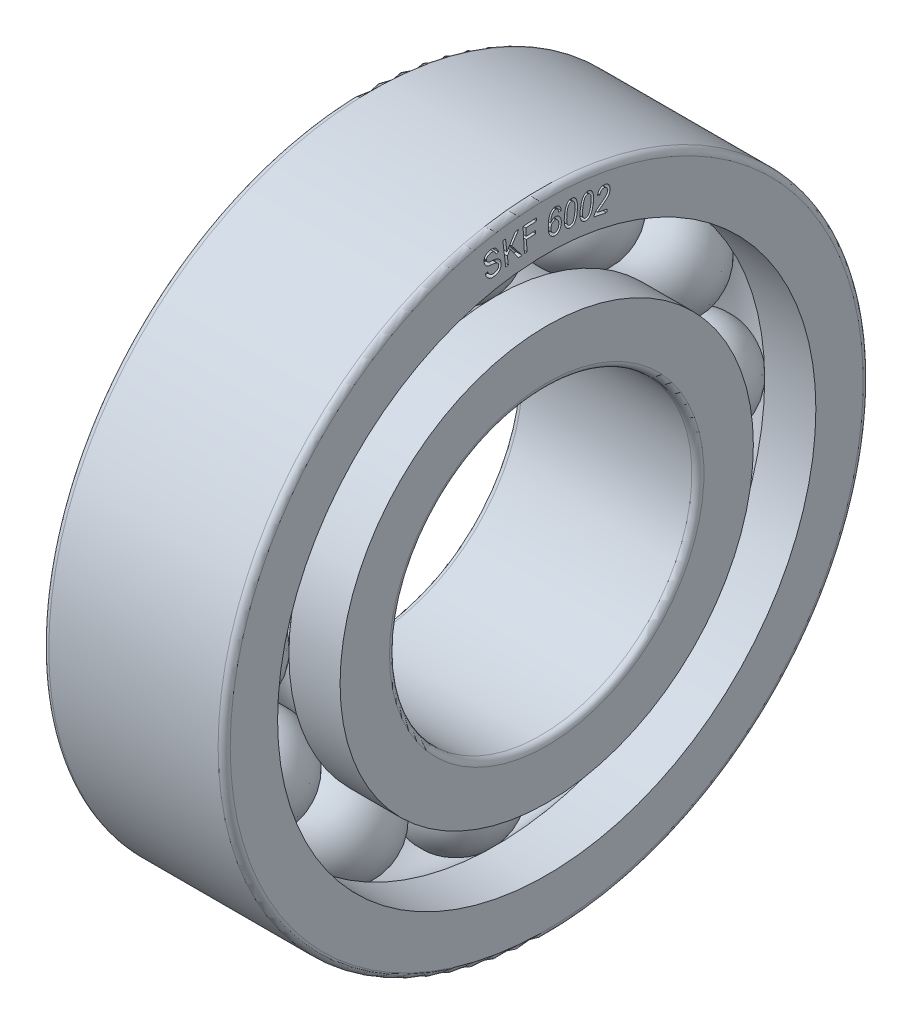
from build123d import *

# Parameters (mm, degrees)
FILLET1_R          = 0.3
FILLET2_R          = 0.3
CIRPATTERN2_COUNT  = 12
CUT_EXTRUDE1_DEPTH = 0.3


with BuildPart() as part:
    # Sketch1 → Revolve1 (revolve)
    with BuildSketch(Plane.XY, mode=Mode.PRIVATE) as revolve1_sk:
        with BuildLine():
            Line((0, 13.35), (2.538495475, 13.35))
            ThreePointArc((2.538495475, 13.35), (4.5, 14.3), (6.461504525, 13.35))
            Line((6.461504525, 13.35), (9, 13.35))
            Line((9, 13.35), (9, 16))
            Line((9, 16), (0, 16))
            Line((0, 16), (0, 13.35))
        make_face()
        with BuildLine():
            Line((0, 7.5), (9, 7.5))
            Line((9, 7.5), (9, 10.25))
            Line((9, 10.25), (6.461504525, 10.25))
            ThreePointArc((6.461504525, 10.25), (4.5, 9.3), (2.538495475, 10.25))
            Line((2.538495475, 10.25), (0, 10.25))
            Line((0, 10.25), (0, 7.5))
        make_face()
    revolve(revolve1_sk.sketch.rotate(Axis((0, 0, 0), (1, 0, 0)), 90), axis=Axis((0, 0, 0), (1, 0, 0)))

    # Fillet1
    fillet1_edges = [part.edges().sort_by_distance(p)[0] for p in [
        (0, 0, -16),
        (9, 0, -16),
    ]]
    fillet(fillet1_edges, radius=FILLET1_R)

    # Fillet2
    fillet2_edges = [part.edges().sort_by_distance(p)[0] for p in [
        (9, 0, -7.5),
        (0, 0, -7.5),
    ]]
    fillet(fillet2_edges, radius=FILLET2_R)

    # Sketch4 → Cut-Extrude1 (cut)
    # profile 1 of 7: a face of its own
    with BuildSketch(Plane(origin=(9, 0, 0), x_dir=(0, 0, -1), z_dir=(1, 0, 0))):
        with BuildLine():
            Line((-3.046650732, 14.00714184), (-2.92806307, 14.042937295))
            add(Edge.make_bspline(
                [(-2.92806307, 14.042937295), (-2.923301458, 14.027825448), (-2.914277799, 13.999187217), (-2.897284214, 13.959900181), (-2.878064176, 13.926640691), (-2.856519588, 13.898826321), (-2.832107487, 13.875936734), (-2.804652981, 13.857083888), (-2.774240384, 13.84139606), (-2.740861304, 13.829319608), (-2.705316332, 13.820993642), (-2.668089749, 13.817493292), (-2.629716039, 13.817994887), (-2.604084929, 13.822153551), (-2.591050083, 13.824268464)],
                knots=[0, 0, 0, 0, 1.26954719, 2.40589959, 3.423657765, 4.341315027, 5.215932511, 6.094943994, 7.002907502, 7.951842905, 8.933583934, 9.920936739, 10.942680602, 12, 12, 12, 12], degree=3))
            add(Edge.make_bspline(
                [(-2.591050083, 13.824268464), (-2.581765006, 13.82616495), (-2.563693597, 13.829856053), (-2.537889809, 13.837431966), (-2.513955786, 13.846404018), (-2.49221225, 13.857238024), (-2.471907098, 13.868789897), (-2.453865498, 13.882307036), (-2.437643865, 13.897189766), (-2.423595439, 13.913566909), (-2.411294627, 13.930851366), (-2.401368313, 13.949017107), (-2.393688814, 13.96791058), (-2.388085389, 13.987328093), (-2.384625857, 14.007581973), (-2.383480417, 14.028399642), (-2.384409269, 14.049952146), (-2.38675906, 14.06430231), (-2.387965667, 14.071671061)],
                knots=[0, 0, 0, 0, 1.2593084, 2.450973213, 3.571176115, 4.6521319, 5.677366795, 6.672228266, 7.641962316, 8.59815497, 9.535160328, 10.457450196, 11.343097648, 12.241276623, 13.138872091, 14.068392264, 15.008127251, 16, 16, 16, 16], degree=3))
            add(Edge.make_bspline(
                [(-2.387965667, 14.071671061), (-2.389877515, 14.080086013), (-2.39360091, 14.096474453), (-2.402366844, 14.119577918), (-2.414035562, 14.14028436), (-2.427960588, 14.158936579), (-2.444401987, 14.175505406), (-2.463733209, 14.189434381), (-2.485558199, 14.201222332), (-2.506194323, 14.208879848), (-2.525328466, 14.2143538), (-2.543456321, 14.218011158), (-2.564855352, 14.222229644), (-2.589772757, 14.226374905), (-2.618294187, 14.230178987), (-2.650300676, 14.233946574), (-2.685733189, 14.238281961), (-2.710524028, 14.240644058), (-2.723517615, 14.2418821)],
                knots=[0, 0, 0, 0, 1.00779301, 1.962715563, 2.875867978, 3.77711567, 4.676013559, 5.592510866, 6.551805949, 7.566673775, 8.158289259, 8.876535978, 9.726811044, 10.707814062, 11.828102411, 13.089528156, 14.474538576, 16, 16, 16, 16], degree=3))
            add(Edge.make_bspline(
                [(-2.723517615, 14.2418821), (-2.735213144, 14.243119933), (-2.757742602, 14.24550441), (-2.790294473, 14.249944509), (-2.820354395, 14.25471972), (-2.847969421, 14.260074926), (-2.873081499, 14.265875277), (-2.895766399, 14.272166467), (-2.916034317, 14.278929023), (-2.939562264, 14.288532414), (-2.96606402, 14.302888458), (-2.995168114, 14.323039529), (-3.021467618, 14.346787134), (-3.045172423, 14.373478746), (-3.065482159, 14.403612702), (-3.081989514, 14.436829636), (-3.09543671, 14.472685151), (-3.100866271, 14.498043265), (-3.103631252, 14.510956776)],
                knots=[0, 0, 0, 0, 1.10964656, 2.137546373, 3.099504595, 3.981192456, 4.791175181, 5.530750114, 6.201623188, 6.806082298, 7.926512849, 9.037691305, 10.138661259, 11.261889133, 12.398329616, 13.556017161, 14.755412262, 16, 16, 16, 16], degree=3))
            add(Edge.make_bspline(
                [(-3.103631252, 14.510956776), (-3.105552518, 14.522699831), (-3.109325733, 14.545762265), (-3.111189847, 14.580182892), (-3.110032929, 14.61344205), (-3.105742961, 14.645642129), (-3.097734588, 14.676643254), (-3.087177552, 14.706814965), (-3.07278872, 14.735676537), (-3.055582645, 14.763374603), (-3.035526337, 14.789343553), (-3.012576466, 14.812928176), (-2.987272727, 14.83416991), (-2.95922176, 14.85278916), (-2.928666165, 14.868833952), (-2.89557194, 14.882495266), (-2.859965469, 14.893755532), (-2.835095278, 14.899068583), (-2.822381252, 14.901784698)],
                knots=[0, 0, 0, 0, 1.053189865, 2.068381731, 3.046662068, 3.997187907, 4.938646346, 5.877686698, 6.822842677, 7.788255941, 8.761691245, 9.722490415, 10.69717237, 11.682059317, 12.698166961, 13.748777853, 14.84914037, 16, 16, 16, 16], degree=3))
            add(Edge.make_bspline(
                [(-2.822381252, 14.901784698), (-2.804813759, 14.904639967), (-2.770561209, 14.910207082), (-2.71965911, 14.911341032), (-2.671153774, 14.906516175), (-2.62527839, 14.895861737), (-2.582289492, 14.879496496), (-2.542720256, 14.857495806), (-2.506991257, 14.829569151), (-2.475343637, 14.796169373), (-2.447451315, 14.758108624), (-2.424302477, 14.715197061), (-2.405292375, 14.668007504), (-2.396898017, 14.634376164), (-2.392592291, 14.617125607)],
                knots=[0, 0, 0, 0, 1.104477071, 2.153475001, 3.151815611, 4.125288377, 5.070058186, 6.000007743, 6.926849633, 7.875405572, 8.849557026, 9.849068203, 10.896720369, 12, 12, 12, 12], degree=3))
            Line((-2.392592291, 14.617125607), (-2.513858524, 14.582547685))
            add(Edge.make_bspline(
                [(-2.513858524, 14.582547685), (-2.516600426, 14.591669176), (-2.521915868, 14.609352073), (-2.531294177, 14.634633406), (-2.542459157, 14.657501678), (-2.55409858, 14.678663799), (-2.567778774, 14.697150095), (-2.582044103, 14.714006336), (-2.597966163, 14.72832123), (-2.614941481, 14.740648493), (-2.633020441, 14.750984534), (-2.652449773, 14.759006134), (-2.672943158, 14.765053831), (-2.694617529, 14.769311345), (-2.717476202, 14.771101001), (-2.741407724, 14.771063598), (-2.766509431, 14.769177592), (-2.78344034, 14.766218921), (-2.792186447, 14.764690542)],
                knots=[0, 0, 0, 0, 1.219554854, 2.364225483, 3.44736661, 4.476085449, 5.451111343, 6.386789839, 7.299146488, 8.184768409, 9.069108721, 9.958928646, 10.869804148, 11.801317367, 12.781811824, 13.800347428, 14.863711533, 16, 16, 16, 16], degree=3))
            add(Edge.make_bspline(
                [(-2.792186447, 14.764690542), (-2.80097383, 14.762834579), (-2.818009407, 14.759236533), (-2.842561316, 14.752459709), (-2.865126736, 14.744253812), (-2.885798988, 14.734678195), (-2.904514059, 14.723977115), (-2.921581902, 14.712316287), (-2.936488071, 14.699089162), (-2.94934706, 14.684698462), (-2.960442261, 14.669560716), (-2.969376537, 14.653618028), (-2.976872692, 14.637340412), (-2.981977273, 14.620283364), (-2.985147274, 14.602718261), (-2.986328611, 14.584592699), (-2.985657219, 14.565969344), (-2.983636557, 14.553555109), (-2.982608524, 14.547239243)],
                knots=[0, 0, 0, 0, 1.322262895, 2.563392233, 3.746844923, 4.853710312, 5.913638557, 6.918215452, 7.891888192, 8.839766151, 9.755373262, 10.649272019, 11.526638814, 12.388648758, 13.263080117, 14.149517218, 15.058548406, 16, 16, 16, 16], degree=3))
            add(Edge.make_bspline(
                [(-2.982608524, 14.547239243), (-2.98005392, 14.535965724), (-2.975180508, 14.51445926), (-2.961055659, 14.4857926), (-2.943358495, 14.461265098), (-2.927600237, 14.449719379), (-2.919783849, 14.44399249)],
                knots=[0, 0, 0, 0, 1.112967713, 2.123205869, 3.069075453, 4, 4, 4, 4], degree=3))
            add(Edge.make_bspline(
                [(-2.919783849, 14.44399249), (-2.915210885, 14.441367193), (-2.905232627, 14.435638768), (-2.887719484, 14.428840922), (-2.867078877, 14.422285434), (-2.843139315, 14.416534826), (-2.815973315, 14.411502528), (-2.78558991, 14.406956549), (-2.751908173, 14.402732653), (-2.728315348, 14.40072496), (-2.715968914, 14.399674308)],
                knots=[0, 0, 0, 0, 0.60165213, 1.312811475, 2.13979566, 3.075369995, 4.122893511, 5.295289476, 6.584589636, 8, 8, 8, 8], degree=3))
            add(Edge.make_bspline(
                [(-2.715968914, 14.399674308), (-2.703789017, 14.398666953), (-2.680388162, 14.396731552), (-2.646724266, 14.393177536), (-2.615749859, 14.389990084), (-2.587534221, 14.385962237), (-2.562042696, 14.382095642), (-2.539244476, 14.378363706), (-2.519302409, 14.373931297), (-2.506951196, 14.370728384), (-2.501196187, 14.369235996)],
                knots=[0, 0, 0, 0, 1.350462932, 2.594602265, 3.7406246, 4.790933121, 5.743598289, 6.590013479, 7.343021209, 8, 8, 8, 8], degree=3))
            add(Edge.make_bspline(
                [(-2.501196187, 14.369235996), (-2.485625294, 14.364099715), (-2.455285497, 14.354091699), (-2.413200751, 14.332975565), (-2.376017761, 14.306978443), (-2.343822483, 14.276215491), (-2.316356685, 14.240923039), (-2.294244548, 14.200872403), (-2.276872924, 14.156226541), (-2.269842219, 14.124390023), (-2.266212421, 14.107953529)],
                knots=[0, 0, 0, 0, 1.056785043, 2.059139661, 3.025273026, 3.973485492, 4.92146656, 5.899070255, 6.915336187, 8, 8, 8, 8], degree=3))
            add(Edge.make_bspline(
                [(-2.266212421, 14.107953529), (-2.263690315, 14.091193147), (-2.258738272, 14.058284868), (-2.258455057, 14.008607444), (-2.265216865, 13.960261763), (-2.27777995, 13.913486524), (-2.296230216, 13.869512338), (-2.319976555, 13.829056728), (-2.34931363, 13.792910079), (-2.383876511, 13.761018087), (-2.423863427, 13.733885162), (-2.468796679, 13.711074282), (-2.519127837, 13.693312611), (-2.554829209, 13.685411971), (-2.573274109, 13.681330152)],
                knots=[0, 0, 0, 0, 1.03110276, 2.02452526, 3.012164937, 3.995280586, 4.965503464, 5.907210424, 6.841953011, 7.789813294, 8.760388578, 9.774929382, 10.850430571, 12, 12, 12, 12], degree=3))
            add(Edge.make_bspline(
                [(-2.573274109, 13.681330152), (-2.587932195, 13.678866845), (-2.61663503, 13.674043303), (-2.659363686, 13.671549638), (-2.700442698, 13.672327177), (-2.739877954, 13.677161744), (-2.777619236, 13.686055768), (-2.813864576, 13.698398365), (-2.848333921, 13.714887358), (-2.880994668, 13.734853577), (-2.911479011, 13.758242088), (-2.939308499, 13.784866836), (-2.964359823, 13.814593385), (-2.98640933, 13.847355982), (-3.00614745, 13.882856093), (-3.022499182, 13.921554578), (-3.036654289, 13.963086368), (-3.043263767, 13.992215096), (-3.046650732, 14.00714184)],
                knots=[0, 0, 0, 0, 1.101815366, 2.15752762, 3.169301812, 4.146094599, 5.098288644, 6.040782667, 6.980676967, 7.926530366, 8.875463887, 9.825084765, 10.77790675, 11.753139638, 12.750207159, 13.785847731, 14.865378402, 16, 16, 16, 16], degree=3))
        make_face()
    # profile 2 of 7: a face of its own
    with BuildSketch(Plane(origin=(9, 0, 0), x_dir=(0, 0, -1), z_dir=(1, 0, 0))):
        Polygon((-2.032785019, 13.798009574), (-2.17718437, 14.991678405), (-2.047882422, 15.00726282), (-1.976291513, 14.415298535), (-1.561599954, 15.066191392), (-1.385788266, 15.087376457), (-1.738629175, 14.554097236), (-1.223612941, 13.895899184), (-1.3945545, 13.875201132), (-1.81606424, 14.437214119), (-1.953645409, 14.227311522), (-1.903483071, 13.813593989), align=None)
    # profile 3 of 7: a face of its own
    with BuildSketch(Plane(origin=(9, 0, 0), x_dir=(0, 0, -1), z_dir=(1, 0, 0))):
        Polygon((-1.10624178, 13.902935611), (-1.17564113, 15.107805741), (-0.509163858, 15.146279767), (-0.501128143, 15.004071974), (-1.036842429, 14.97314665), (-1.015170351, 14.600094702), (-0.551777494, 14.626880416), (-0.54374178, 14.484672624), (-1.007134637, 14.45788691), (-0.975478793, 13.910484312), align=None)
    # profile 4 of 7: a face of its own
    with BuildSketch(Plane(origin=(9, 0, 0), x_dir=(0, 0, -1), z_dir=(1, 0, 0))):
        with BuildLine():
            Line((0.720598831, 14.84074259), (0.599576104, 14.832706876))
            add(Edge.make_bspline(
                [(0.599576104, 14.832706876), (0.597009192, 14.847219242), (0.592216782, 14.874313746), (0.581531024, 14.911184161), (0.569193021, 14.941934512), (0.557650268, 14.95851471), (0.552335844, 14.966148434)],
                knots=[0, 0, 0, 0, 1.236380282, 2.308314765, 3.221127598, 4, 4, 4, 4], degree=3))
            add(Edge.make_bspline(
                [(0.552335844, 14.966148434), (0.548353343, 14.970843347), (0.540581809, 14.980005095), (0.527902145, 14.992306851), (0.514373789, 15.002620207), (0.500218273, 15.011122955), (0.485521708, 15.01813296), (0.470005736, 15.022927109), (0.453844376, 15.026204429), (0.44277349, 15.026910418), (0.437157273, 15.027268564)],
                knots=[0, 0, 0, 0, 1.095410301, 2.13760608, 3.137382949, 4.116060655, 5.072628854, 6.027559187, 6.999388418, 8, 8, 8, 8], degree=3))
            add(Edge.make_bspline(
                [(0.437157273, 15.027268564), (0.428445676, 15.027066389), (0.411331365, 15.026669206), (0.386148191, 15.02113258), (0.362437479, 15.011242836), (0.339825584, 14.997293001), (0.318604554, 14.979036408), (0.29870055, 14.956629701), (0.279684643, 14.930357764), (0.268918845, 14.910682271), (0.263293637, 14.900401681)],
                knots=[0, 0, 0, 0, 0.916849156, 1.801189937, 2.69883847, 3.612969371, 4.59010406, 5.638077774, 6.765878283, 8, 8, 8, 8], degree=3))
            add(Edge.make_bspline(
                [(0.263293637, 14.900401681), (0.258581182, 14.890570237), (0.248782003, 14.870126524), (0.236874683, 14.836794262), (0.226032143, 14.800269739), (0.217482575, 14.760086404), (0.21024958, 14.716610147), (0.204388886, 14.669664414), (0.20027174, 14.619374282), (0.198955034, 14.584662092), (0.198277403, 14.566797785)],
                knots=[0, 0, 0, 0, 0.763653091, 1.587956324, 2.477226605, 3.432398784, 4.46489177, 5.565636566, 6.747177368, 8, 8, 8, 8], degree=3))
            add(Edge.make_bspline(
                [(0.198277403, 14.566797785), (0.205762689, 14.579186291), (0.220265634, 14.603189356), (0.246545721, 14.634799808), (0.274737678, 14.662097894), (0.305998989, 14.683636783), (0.338443815, 14.700914876), (0.372308114, 14.712590597), (0.406804015, 14.719903739), (0.430140949, 14.720105978), (0.441783896, 14.720206876)],
                knots=[0, 0, 0, 0, 1.145987755, 2.22038229, 3.249078672, 4.247004615, 5.219843421, 6.153966187, 7.079001852, 8, 8, 8, 8], degree=3))
            add(Edge.make_bspline(
                [(0.441783896, 14.720206876), (0.451391577, 14.719641742), (0.470530245, 14.718515987), (0.49855602, 14.71245733), (0.525534544, 14.703444642), (0.551505031, 14.691094335), (0.576265638, 14.675185912), (0.600005344, 14.655985429), (0.622764119, 14.633657147), (0.644253965, 14.608265498), (0.663934578, 14.580130828), (0.681084395, 14.549584929), (0.695155795, 14.516717957), (0.706689575, 14.481792041), (0.715081883, 14.444586319), (0.720951769, 14.405283871), (0.723847034, 14.363757747), (0.723631383, 14.335388922), (0.723520909, 14.320856226)],
                knots=[0, 0, 0, 0, 0.849327429, 1.691875088, 2.524226795, 3.35830704, 4.225761169, 5.118464095, 6.051648941, 7.038832616, 8.053535028, 9.081032545, 10.128240177, 11.207808131, 12.32647642, 13.493924435, 14.716195167, 16, 16, 16, 16], degree=3))
            add(Edge.make_bspline(
                [(0.723520909, 14.320856226), (0.7224559, 14.301175445), (0.720366329, 14.262561325), (0.710540937, 14.206267325), (0.695020034, 14.15302669), (0.677976961, 14.111008696), (0.661442044, 14.079801248), (0.649064773, 14.057729722), (0.635169815, 14.037819184), (0.621112859, 14.019088994), (0.606039371, 14.002078299), (0.590187302, 13.986769203), (0.573815102, 13.97288114), (0.550903439, 13.957306365), (0.521128247, 13.940887411), (0.483220279, 13.927073233), (0.443567761, 13.919334113), (0.416654447, 13.918835328), (0.403066364, 13.918583499)],
                knots=[0, 0, 0, 0, 1.650803297, 3.238911819, 4.776053236, 6.292019915, 7.028348408, 7.735437623, 8.410929891, 9.061291689, 9.697408685, 10.313194819, 10.907215888, 11.494065414, 12.632559363, 13.747290788, 14.862644748, 16, 16, 16, 16], degree=3))
            add(Edge.make_bspline(
                [(0.403066364, 13.918583499), (0.390854586, 13.919331586), (0.366791903, 13.920805654), (0.331764261, 13.928290767), (0.298541254, 13.939801263), (0.267121315, 13.955541071), (0.237475079, 13.975471932), (0.209485994, 13.999554041), (0.183560818, 14.02798198), (0.159043817, 14.060394718), (0.13731193, 14.097920573), (0.118862191, 14.140944687), (0.10364893, 14.189429272), (0.091643432, 14.243373037), (0.082761906, 14.302775269), (0.076998318, 14.367657046), (0.07471726, 14.438131742), (0.075425873, 14.486927693), (0.075793637, 14.51225233)],
                knots=[0, 0, 0, 0, 0.772682147, 1.522530541, 2.256134036, 2.990562792, 3.73782516, 4.509330465, 5.31922407, 6.166000266, 7.074374683, 8.053506931, 9.119834925, 10.282666614, 11.544110306, 12.914761338, 14.398790295, 16, 16, 16, 16], degree=3))
            add(Edge.make_bspline(
                [(0.075793637, 14.51225233), (0.076846554, 14.540350795), (0.078872917, 14.594426913), (0.085747819, 14.672347252), (0.095259579, 14.74390334), (0.107841374, 14.809142134), (0.12317894, 14.868095809), (0.141867556, 14.92056498), (0.163218921, 14.966870041), (0.18765204, 15.00696375), (0.214804064, 15.041140479), (0.242968901, 15.07100716), (0.273160712, 15.095747134), (0.304800613, 15.116035524), (0.33822544, 15.131519713), (0.373337274, 15.142337321), (0.410161132, 15.148315038), (0.435188404, 15.148460886), (0.447871559, 15.148534798)],
                knots=[0, 0, 0, 0, 1.641067973, 3.158271576, 4.564049669, 5.852839019, 7.034251358, 8.116259258, 9.099737573, 10.005768793, 10.849329324, 11.643505027, 12.397562096, 13.121780427, 13.831913651, 14.540781322, 15.260506814, 16, 16, 16, 16], degree=3))
            add(Edge.make_bspline(
                [(0.447871559, 15.148534798), (0.457062466, 15.148070325), (0.475216575, 15.147152886), (0.501684399, 15.142605224), (0.527069579, 15.13618602), (0.550979332, 15.126769911), (0.573756353, 15.115206097), (0.595631138, 15.101695164), (0.615783833, 15.085123633), (0.634846332, 15.066621592), (0.652436834, 15.045924372), (0.668078391, 15.022889211), (0.681672767, 14.997605924), (0.693659916, 14.97038607), (0.703375584, 14.940921032), (0.711026818, 14.909381042), (0.71730622, 14.875832352), (0.719484533, 14.852617805), (0.720598831, 14.84074259)],
                knots=[0, 0, 0, 0, 0.968540519, 1.913085379, 2.823463735, 3.72212398, 4.613023276, 5.512049484, 6.424032314, 7.355131703, 8.30753763, 9.279806868, 10.282172273, 11.327377702, 12.40884574, 13.545191558, 14.744262386, 16, 16, 16, 16], degree=3))
        make_face()
        with BuildLine():
            add(Edge.make_bspline(
                [(0.210696234, 14.334979603), (0.21051902, 14.324341404), (0.21017362, 14.30360697), (0.212628654, 14.273287281), (0.216244712, 14.244412869), (0.222539071, 14.217131397), (0.230089795, 14.191174351), (0.240251173, 14.166954128), (0.252113148, 14.14422499), (0.266002389, 14.12332495), (0.281246912, 14.10456419), (0.297077332, 14.08780036), (0.313706799, 14.073556779), (0.33109475, 14.061783802), (0.349175881, 14.052322168), (0.368115051, 14.045925669), (0.387499174, 14.041168148), (0.400764898, 14.0404534), (0.407449481, 14.040093239)],
                knots=[0, 0, 0, 0, 1.299560296, 2.532914284, 3.714222581, 4.852640015, 5.951064926, 7.014066507, 8.056879126, 9.080402987, 10.075059155, 11.008253797, 11.894887359, 12.745087238, 13.570323278, 14.379786338, 15.183576162, 16, 16, 16, 16], degree=3))
            add(Edge.make_bspline(
                [(0.407449481, 14.040093239), (0.41330434, 14.040187087), (0.425009548, 14.040374708), (0.442405993, 14.043353268), (0.459428737, 14.048810463), (0.475978817, 14.056693357), (0.492200733, 14.066753127), (0.507858618, 14.079294594), (0.522863736, 14.094353352), (0.53779228, 14.111171624), (0.551239991, 14.130453672), (0.563640018, 14.151391883), (0.57364665, 14.174495747), (0.582568169, 14.199063163), (0.589315055, 14.225591862), (0.594268394, 14.253851635), (0.59814379, 14.283908522), (0.598928865, 14.304609753), (0.599332598, 14.315255577)],
                knots=[0, 0, 0, 0, 0.757529254, 1.514474783, 2.275787342, 3.065806442, 3.882578432, 4.742839754, 5.657152373, 6.633195641, 7.6511357, 8.696866962, 9.779155802, 10.906307873, 12.079151298, 13.318378039, 14.620947872, 16, 16, 16, 16], degree=3))
            add(Edge.make_bspline(
                [(0.599332598, 14.315255577), (0.599482369, 14.32564817), (0.599774029, 14.345886461), (0.597710314, 14.375410843), (0.594152382, 14.403161813), (0.588826743, 14.429250343), (0.581555774, 14.453528911), (0.572569905, 14.476058066), (0.56175093, 14.496805982), (0.549133791, 14.515649357), (0.535279501, 14.532610207), (0.520735579, 14.547712027), (0.504917166, 14.56010083), (0.488574674, 14.570798879), (0.471183676, 14.579038189), (0.45300503, 14.585298537), (0.433878945, 14.588874913), (0.420855337, 14.589737892), (0.414267663, 14.590174408)],
                knots=[0, 0, 0, 0, 1.347826659, 2.624725776, 3.835480647, 4.975436095, 6.074789488, 7.118949584, 8.117459131, 9.104577188, 10.055129957, 10.956097769, 11.817813898, 12.656115295, 13.485039498, 14.307518056, 15.143899399, 16, 16, 16, 16], degree=3))
            add(Edge.make_bspline(
                [(0.414267663, 14.590174408), (0.407758937, 14.590206323), (0.394911924, 14.590269315), (0.375939475, 14.586963677), (0.357400738, 14.582431845), (0.339716705, 14.574691689), (0.32227088, 14.565639039), (0.305701641, 14.55368386), (0.289585856, 14.539735369), (0.274079148, 14.523773509), (0.259769002, 14.505909739), (0.247284913, 14.486194302), (0.236482654, 14.464956241), (0.227832596, 14.441954629), (0.220731542, 14.417452342), (0.215390907, 14.391405086), (0.21199232, 14.363713737), (0.211135994, 14.344729056), (0.210696234, 14.334979603)],
                knots=[0, 0, 0, 0, 0.857866244, 1.693268336, 2.535724984, 3.371883313, 4.235157804, 5.127431022, 6.062284454, 7.047823107, 8.062377194, 9.079420156, 10.124549348, 11.203599197, 12.319764685, 13.490796619, 14.711415766, 16, 16, 16, 16], degree=3))
        make_face(mode=Mode.SUBTRACT)
    # profile 5 of 7: a face of its own
    with BuildSketch(Plane(origin=(9, 0, 0), x_dir=(0, 0, -1), z_dir=(1, 0, 0))):
        with BuildLine():
            add(Edge.make_bspline(
                [(0.875856696, 14.518158089), (0.878089291, 14.542693366), (0.882408875, 14.590163767), (0.891993143, 14.658804155), (0.903545701, 14.72269724), (0.917379743, 14.781776816), (0.93302777, 14.836215574), (0.951342354, 14.885619411), (0.971328446, 14.93054393), (0.994081111, 14.970311423), (1.01853123, 15.005520015), (1.04555042, 15.035410582), (1.074287955, 15.060750747), (1.105614166, 15.080228653), (1.138573213, 15.095342619), (1.173848884, 15.104355816), (1.211052539, 15.109062557), (1.236399156, 15.107831515), (1.249395657, 15.107200297)],
                knots=[0, 0, 0, 0, 1.521346898, 2.943473916, 4.278713154, 5.529911206, 6.689495768, 7.774345618, 8.781651592, 9.722395364, 10.600010787, 11.423470149, 12.205353942, 12.957773308, 13.69376531, 14.435488139, 15.197795087, 16, 16, 16, 16], degree=3))
            add(Edge.make_bspline(
                [(1.249395657, 15.107200297), (1.260890675, 15.10586556), (1.283330513, 15.103259971), (1.315669134, 15.094526033), (1.345746046, 15.082142884), (1.373646437, 15.065791438), (1.39941182, 15.04577228), (1.422613922, 15.021449489), (1.444010534, 14.993729584), (1.455734847, 14.972946907), (1.461733319, 14.962313933)],
                knots=[0, 0, 0, 0, 1.030683207, 2.012033701, 2.975718226, 3.922818163, 4.887018906, 5.874833161, 6.912707739, 8, 8, 8, 8], degree=3))
            add(Edge.make_bspline(
                [(1.461733319, 14.962313933), (1.46865264, 14.948171252), (1.483059648, 14.918724183), (1.498569752, 14.86979709), (1.511221982, 14.815745818), (1.520432925, 14.756164242), (1.525471158, 14.691058516), (1.527295049, 14.620601826), (1.525907145, 14.544698252), (1.522131633, 14.492414546), (1.520174878, 14.46531718)],
                knots=[0, 0, 0, 0, 0.745131214, 1.551468977, 2.424633835, 3.374356247, 4.404703284, 5.516606919, 6.712918134, 8, 8, 8, 8], degree=3))
            add(Edge.make_bspline(
                [(1.520174878, 14.46531718), (1.517936821, 14.440945111), (1.513600212, 14.393720164), (1.504066625, 14.325393772), (1.492416148, 14.261869503), (1.478957044, 14.202851878), (1.4629146, 14.148727537), (1.445058712, 14.099109366), (1.424496739, 14.054506068), (1.402364083, 14.014308787), (1.377591553, 13.979298615), (1.351168003, 13.948914279), (1.322030149, 13.924057409), (1.291017805, 13.904007517), (1.257637076, 13.88956716), (1.222409812, 13.879948809), (1.185047498, 13.875429349), (1.159628297, 13.876633518), (1.146635917, 13.877248998)],
                knots=[0, 0, 0, 0, 1.513106966, 2.931897048, 4.263734174, 5.505454272, 6.672602746, 7.752256164, 8.762802756, 9.706524186, 10.585147916, 11.40995044, 12.189459829, 12.945430483, 13.68482732, 14.428707038, 15.19687342, 16, 16, 16, 16], degree=3))
            add(Edge.make_bspline(
                [(1.146635917, 13.877248998), (1.135140152, 13.878665552), (1.112511871, 13.881453898), (1.079751514, 13.890576028), (1.049061657, 13.904119722), (1.020332394, 13.921845859), (0.993519318, 13.943750063), (0.96898871, 13.97005776), (0.94617668, 14.00030201), (0.925290185, 14.03489954), (0.907094054, 14.074738799), (0.892755232, 14.120499215), (0.881275059, 14.172044548), (0.873968739, 14.229760652), (0.868925388, 14.293387281), (0.868138265, 14.363055306), (0.869939115, 14.438694329), (0.873832686, 14.490978833), (0.875856696, 14.518158089)],
                knots=[0, 0, 0, 0, 0.716638781, 1.410632827, 2.097158056, 2.787775514, 3.495186193, 4.234869867, 5.010053768, 5.837709639, 6.733040743, 7.715525963, 8.802239241, 9.999490202, 11.31540851, 12.753377348, 14.312295605, 16, 16, 16, 16], degree=3))
        make_face()
        with BuildLine():
            add(Edge.make_bspline(
                [(1.000045008, 14.508174323), (0.998283445, 14.484724955), (0.994909074, 14.439806405), (0.992250995, 14.375246163), (0.991534267, 14.31659986), (0.993445413, 14.263863436), (0.997392913, 14.217012352), (1.003615342, 14.175984969), (1.011723298, 14.140675492), (1.022931358, 14.111050363), (1.035929616, 14.086063762), (1.049692952, 14.06424271), (1.064827341, 14.045520902), (1.081311565, 14.029983037), (1.099033915, 14.017311694), (1.118093117, 14.007804305), (1.138469613, 14.001218391), (1.152597137, 13.9994268), (1.159785267, 13.998515232)],
                knots=[0, 0, 0, 0, 1.92314131, 3.68388271, 5.283838081, 6.718756759, 7.998352587, 9.126912951, 10.110701872, 10.955291298, 11.709436333, 12.411057138, 13.062180695, 13.672714495, 14.258454896, 14.837384131, 15.408457268, 16, 16, 16, 16], degree=3))
            add(Edge.make_bspline(
                [(1.159785267, 13.998515232), (1.166612854, 13.998290041), (1.180188705, 13.997842275), (1.200357459, 14.001172539), (1.219869682, 14.007639696), (1.238836293, 14.017202111), (1.25690089, 14.030435607), (1.274513008, 14.046562461), (1.291250413, 14.066090863), (1.307987865, 14.088727052), (1.323539482, 14.116455103), (1.337682579, 14.149867056), (1.35047519, 14.18942737), (1.361936964, 14.234934718), (1.372434143, 14.286436474), (1.381153244, 14.344097067), (1.389339717, 14.407725335), (1.393229375, 14.452312639), (1.395256047, 14.475544453)],
                knots=[0, 0, 0, 0, 0.562620387, 1.118704284, 1.675755424, 2.253870527, 2.863523135, 3.517722874, 4.2202644, 4.9825564, 5.837419796, 6.836501917, 7.971784545, 9.264888244, 10.707185334, 12.307189414, 14.075894213, 16, 16, 16, 16], degree=3))
            add(Edge.make_bspline(
                [(1.395256047, 14.475544453), (1.397003892, 14.499075049), (1.400346494, 14.54407526), (1.403180471, 14.608715612), (1.403348559, 14.667439519), (1.401929654, 14.720262408), (1.397977967, 14.767219454), (1.391413439, 14.808124857), (1.383309517, 14.843361338), (1.372117232, 14.872907475), (1.359187905, 14.897852757), (1.34531716, 14.919599068), (1.329898344, 14.938204279), (1.313329583, 14.953980815), (1.295338173, 14.966692609), (1.275855275, 14.975917181), (1.255199013, 14.982479257), (1.240836319, 14.984288124), (1.233567735, 14.985203544)],
                knots=[0, 0, 0, 0, 1.924557662, 3.680548627, 5.276146154, 6.713580935, 7.989724448, 9.116271559, 10.090974121, 10.933284867, 11.685395238, 12.379557001, 13.033129086, 13.651374375, 14.240949521, 14.821345652, 15.403513875, 16, 16, 16, 16], degree=3))
            add(Edge.make_bspline(
                [(1.233567735, 14.985203544), (1.226826645, 14.985397841), (1.213435099, 14.985783822), (1.193335656, 14.982900189), (1.17407522, 14.976046238), (1.155194936, 14.966471075), (1.137282666, 14.953343889), (1.119650844, 14.937310756), (1.103157915, 14.917634876), (1.086352098, 14.894993667), (1.070692523, 14.867369473), (1.057300874, 14.833714842), (1.044217196, 14.794352318), (1.033225772, 14.748733256), (1.022605553, 14.697290054), (1.013840013, 14.639638034), (1.006048084, 14.575973109), (1.002101697, 14.531402582), (1.000045008, 14.508174323)],
                knots=[0, 0, 0, 0, 0.556976301, 1.106464052, 1.666705213, 2.239937703, 2.850745935, 3.496704665, 4.205645804, 4.969382762, 5.82586659, 6.821610269, 7.959044875, 9.252947625, 10.697978653, 12.301015612, 14.072246985, 16, 16, 16, 16], degree=3))
        make_face(mode=Mode.SUBTRACT)
    # profile 6 of 7: a face of its own
    with BuildSketch(Plane(origin=(9, 0, 0), x_dir=(0, 0, -1), z_dir=(1, 0, 0))):
        with BuildLine():
            add(Edge.make_bspline(
                [(1.669231184, 14.44677621), (1.672871149, 14.470993514), (1.679928018, 14.517944054), (1.693054424, 14.585719638), (1.708052077, 14.648641022), (1.725041202, 14.706699436), (1.743856228, 14.759889704), (1.76492981, 14.808060564), (1.787328101, 14.851586288), (1.812001527, 14.89010109), (1.838515628, 14.923636855), (1.866779356, 14.952218868), (1.897017615, 14.975408237), (1.928963347, 14.993448521), (1.962777436, 15.006308523), (1.998319655, 15.013854179), (2.035685953, 15.016147882), (2.060805089, 15.013537736), (2.07369547, 15.012198288)],
                knots=[0, 0, 0, 0, 1.517494929, 2.941995795, 4.276704636, 5.524571904, 6.689208241, 7.770443054, 8.780639408, 9.71966391, 10.600288428, 11.4254681, 12.204157477, 12.95411298, 13.691205316, 14.437050424, 15.197941558, 16, 16, 16, 16], degree=3))
            add(Edge.make_bspline(
                [(2.07369547, 15.012198288), (2.085037311, 15.010189562), (2.107230894, 15.006258909), (2.139006171, 14.995973316), (2.168142477, 14.981682201), (2.195090331, 14.963970474), (2.219568113, 14.942452109), (2.241205237, 14.916962733), (2.261093598, 14.888337384), (2.271610694, 14.867060781), (2.277023392, 14.856110626)],
                knots=[0, 0, 0, 0, 1.029497127, 2.01450797, 2.97568219, 3.924157973, 4.891319171, 5.87966927, 6.908756668, 8, 8, 8, 8], degree=3))
            add(Edge.make_bspline(
                [(2.277023392, 14.856110626), (2.283129734, 14.841621645), (2.29584283, 14.811456318), (2.308726269, 14.761873434), (2.318130055, 14.707297093), (2.323861751, 14.64747259), (2.325637121, 14.582406783), (2.323538321, 14.512183416), (2.317621207, 14.436787385), (2.311089609, 14.3849828), (2.30770521, 14.358139846)],
                knots=[0, 0, 0, 0, 0.746422055, 1.554013156, 2.427301531, 3.37692325, 4.407349378, 5.518750213, 6.714320886, 8, 8, 8, 8], degree=3))
            add(Edge.make_bspline(
                [(2.30770521, 14.358139846), (2.304064475, 14.334003895), (2.297006773, 14.287215438), (2.283893523, 14.219678656), (2.268833206, 14.15693908), (2.251968434, 14.099000486), (2.232945408, 14.045894689), (2.212160761, 13.997671611), (2.189446996, 13.954237126), (2.165039694, 13.91555355), (2.138388725, 13.88212153), (2.110389368, 13.85325575), (2.079927934, 13.830333251), (2.047928834, 13.812115902), (2.014046245, 13.799433878), (1.978386857, 13.791718749), (1.94092187, 13.789508951), (1.915643293, 13.792117967), (1.902753912, 13.793448288)],
                knots=[0, 0, 0, 0, 1.512985827, 2.932980352, 4.26320274, 5.511448993, 6.671702777, 7.757879196, 8.763925439, 9.707470667, 10.588362637, 11.410242733, 12.19317239, 12.94335566, 13.685378159, 14.42653011, 15.197697968, 16, 16, 16, 16], degree=3))
            add(Edge.make_bspline(
                [(1.902753912, 13.793448288), (1.891394404, 13.795405271), (1.868938047, 13.799273988), (1.83696562, 13.81050431), (1.806958572, 13.825356892), (1.779715318, 13.845032521), (1.753942536, 13.867916994), (1.73120828, 13.895669955), (1.710099817, 13.926931264), (1.691445319, 13.962613724), (1.675749091, 14.003302248), (1.663651347, 14.049592317), (1.65575764, 14.101741584), (1.650841512, 14.159579194), (1.65027137, 14.223259487), (1.652637159, 14.292663467), (1.659208319, 14.367871327), (1.665800564, 14.419768693), (1.669231184, 14.44677621)],
                knots=[0, 0, 0, 0, 0.71478908, 1.413050569, 2.096153049, 2.787078944, 3.493769436, 4.230875053, 5.008252246, 5.83353234, 6.725694255, 7.71124024, 8.798589495, 9.997578281, 11.313461578, 12.751061055, 14.309244152, 16, 16, 16, 16], degree=3))
        make_face()
        with BuildLine():
            add(Edge.make_bspline(
                [(1.792201964, 14.429730755), (1.789156868, 14.406450087), (1.783329519, 14.361898257), (1.776917372, 14.297839557), (1.773110527, 14.239523222), (1.772077743, 14.186868564), (1.773369946, 14.139958276), (1.777052767, 14.098745262), (1.783362485, 14.063193989), (1.79264445, 14.032990095), (1.804295539, 14.007367689), (1.816732377, 13.984835002), (1.83100716, 13.965469383), (1.846416462, 13.948794856), (1.863512862, 13.935297082), (1.882098834, 13.925070222), (1.901816335, 13.917061289), (1.915833907, 13.914698826), (1.922964951, 13.913496989)],
                knots=[0, 0, 0, 0, 1.92492439, 3.683695927, 5.277347343, 6.715052973, 8.000069879, 9.123152638, 10.104700157, 10.95507081, 11.705778151, 12.4090601, 13.061274604, 13.673308687, 14.265744635, 14.83779544, 15.408761347, 16, 16, 16, 16], degree=3))
            add(Edge.make_bspline(
                [(1.922964951, 13.913496989), (1.929777879, 13.912870372), (1.943261293, 13.911630238), (1.96355468, 13.913658873), (1.983293035, 13.919222329), (2.002623625, 13.927747137), (2.021400393, 13.939844723), (2.039869732, 13.954872548), (2.057595133, 13.973513734), (2.075656676, 13.995134799), (2.092479442, 14.02199833), (2.108623688, 14.054380178), (2.123126668, 14.093114935), (2.137164442, 14.137760769), (2.150574882, 14.18843086), (2.162487266, 14.245385255), (2.173994155, 14.308294943), (2.180415325, 14.352434502), (2.183760405, 14.375428807)],
                knots=[0, 0, 0, 0, 0.565169511, 1.118522608, 1.675774894, 2.256105427, 2.859827575, 3.518575051, 4.221514305, 4.98516913, 5.845933173, 6.837131056, 7.974650569, 9.263991743, 10.708999995, 12.309528963, 14.077465652, 16, 16, 16, 16], degree=3))
            add(Edge.make_bspline(
                [(2.183760405, 14.375428807), (2.186808105, 14.398709265), (2.192650924, 14.443340788), (2.199041686, 14.507563675), (2.202855578, 14.566043613), (2.203854316, 14.618693307), (2.20269048, 14.66554497), (2.198580217, 14.706638652), (2.192422448, 14.742146122), (2.183010291, 14.772229059), (2.171487623, 14.797744406), (2.158932293, 14.820191994), (2.144471338, 14.839468013), (2.128820649, 14.856046141), (2.111685551, 14.86969002), (2.092820172, 14.8799151), (2.072715481, 14.887757327), (2.058496787, 14.890349332), (2.051292873, 14.891662574)],
                knots=[0, 0, 0, 0, 1.921346146, 3.683458731, 5.280777249, 6.715810326, 7.991799204, 9.113443528, 10.093166448, 10.935616649, 11.6849285, 12.381128047, 13.036083126, 13.651548827, 14.242883496, 14.819675696, 15.401987564, 16, 16, 16, 16], degree=3))
            add(Edge.make_bspline(
                [(2.051292873, 14.891662574), (2.044555848, 14.892326119), (2.031215648, 14.893640027), (2.011174284, 14.89105994), (1.99146996, 14.886084666), (1.972255123, 14.877337402), (1.953679231, 14.865123277), (1.935345295, 14.849967435), (1.917625691, 14.831413028), (1.899591738, 14.809771458), (1.882706975, 14.782980656), (1.866933254, 14.750456733), (1.852280557, 14.711854345), (1.838561966, 14.667141477), (1.825531197, 14.616415272), (1.813077172, 14.559676216), (1.802059859, 14.49675113), (1.795583131, 14.45271813), (1.792201964, 14.429730755)],
                knots=[0, 0, 0, 0, 0.559697232, 1.108274626, 1.665009295, 2.240472357, 2.849147365, 3.504146203, 4.208636214, 4.97397574, 5.836638718, 6.827031329, 7.967060327, 9.257228209, 10.703718209, 12.309203896, 14.073224342, 16, 16, 16, 16], degree=3))
        make_face(mode=Mode.SUBTRACT)
    # profile 7 of 7: a face of its own
    with BuildSketch(Plane(origin=(9, 0, 0), x_dir=(0, 0, -1), z_dir=(1, 0, 0))):
        with BuildLine():
            Line((2.998605157, 13.767817272), (2.971575936, 13.628288051))
            Line((2.971575936, 13.628288051), (2.330423339, 13.752963376))
            add(Edge.make_bspline(
                [(2.330423339, 13.752963376), (2.331759075, 13.76013532), (2.334473641, 13.7747106), (2.341011599, 13.796490277), (2.349250898, 13.818524852), (2.359367053, 13.840878611), (2.371280421, 13.863508162), (2.385253103, 13.886337696), (2.400847458, 13.909557401), (2.418520047, 13.933081271), (2.438623123, 13.957183545), (2.461869856, 13.981657416), (2.487890115, 14.006983933), (2.517035866, 14.032829105), (2.549126832, 14.059294203), (2.584337689, 14.086355703), (2.622541353, 14.114068982), (2.649292066, 14.132408832), (2.663053209, 14.141843246)],
                knots=[0, 0, 0, 0, 0.666370935, 1.354241245, 2.074933872, 2.815402001, 3.595257683, 4.410818644, 5.260618336, 6.150873184, 7.098854106, 8.12752765, 9.234519571, 10.416810373, 11.686811085, 13.035664701, 14.475082115, 16, 16, 16, 16], degree=3))
            add(Edge.make_bspline(
                [(2.663053209, 14.141843246), (2.678999842, 14.152665124), (2.709687428, 14.173490671), (2.753407105, 14.204447428), (2.792933963, 14.233875808), (2.828712412, 14.261290474), (2.860105909, 14.287422034), (2.887681819, 14.311646908), (2.911191834, 14.334225002), (2.936429897, 14.361748122), (2.962536881, 14.394911199), (2.987402117, 14.435025716), (3.005923643, 14.474874635), (3.012644682, 14.502180551), (3.015894118, 14.515382207)],
                knots=[0, 0, 0, 0, 1.318263126, 2.536856202, 3.663980183, 4.689046663, 5.619610674, 6.457414542, 7.19953071, 7.847910998, 9.010789656, 10.080188666, 11.071824266, 12, 12, 12, 12], degree=3))
            add(Edge.make_bspline(
                [(3.015894118, 14.515382207), (3.017141926, 14.522753369), (3.019599651, 14.537271866), (3.021304424, 14.558855765), (3.021128709, 14.579729028), (3.018872805, 14.599771361), (3.015003518, 14.619199477), (3.009218447, 14.637929708), (3.00129114, 14.655808527), (2.991791396, 14.672816007), (2.980977683, 14.688789852), (2.968781961, 14.703304192), (2.955234922, 14.715820709), (2.941168888, 14.727448696), (2.925287839, 14.736410438), (2.908816194, 14.744748852), (2.890878203, 14.750706201), (2.878499552, 14.753550785), (2.872225287, 14.754992596)],
                knots=[0, 0, 0, 0, 1.147869021, 2.26088245, 3.320673438, 4.349128472, 5.35403965, 6.35956933, 7.353281643, 8.352297953, 9.348197686, 10.312377744, 11.256027115, 12.178941729, 13.106895041, 14.049225774, 15.011227074, 16, 16, 16, 16], degree=3))
            add(Edge.make_bspline(
                [(2.872225287, 14.754992596), (2.865422804, 14.756096337), (2.852038726, 14.75826798), (2.832039938, 14.75924857), (2.812588895, 14.758073553), (2.793753764, 14.754562351), (2.775331613, 14.749250359), (2.757570452, 14.74162205), (2.74032416, 14.732033405), (2.723852804, 14.720344068), (2.708122551, 14.706690537), (2.693880036, 14.69081572), (2.680751995, 14.673131419), (2.669419319, 14.653243714), (2.659192654, 14.631495555), (2.650113476, 14.607765502), (2.642681925, 14.581982398), (2.638762129, 14.564026709), (2.636754508, 14.554830259)],
                knots=[0, 0, 0, 0, 0.949597923, 1.868360836, 2.754228201, 3.630071788, 4.504770668, 5.392332934, 6.289090073, 7.220578465, 8.172284266, 9.154683488, 10.15520957, 11.20323858, 12.304583417, 13.466413447, 14.702360936, 16, 16, 16, 16], degree=3))
            Line((2.636754508, 14.554830259), (2.51719282, 14.594034804))
            add(Edge.make_bspline(
                [(2.51719282, 14.594034804), (2.521044322, 14.607576315), (2.528530897, 14.633898389), (2.542854462, 14.671129821), (2.558385757, 14.705582247), (2.575803889, 14.736877584), (2.594941923, 14.765155394), (2.615591179, 14.790500515), (2.638426115, 14.812394279), (2.662528529, 14.831595235), (2.688283663, 14.847424657), (2.715195372, 14.860446588), (2.743299496, 14.870411161), (2.77248256, 14.877587845), (2.802792057, 14.88147795), (2.834176624, 14.881968946), (2.866728351, 14.880265548), (2.888567742, 14.876487343), (2.899741521, 14.874554285)],
                knots=[0, 0, 0, 0, 1.27085825, 2.470302427, 3.598717924, 4.681668527, 5.700286683, 6.679226295, 7.627919878, 8.551820226, 9.457065869, 10.35213335, 11.247110773, 12.144965559, 13.061478907, 14.000036097, 14.976750063, 16, 16, 16, 16], degree=3))
            add(Edge.make_bspline(
                [(2.899741521, 14.874554285), (2.911649504, 14.871935779), (2.934869444, 14.866829832), (2.967917475, 14.85563676), (2.997960312, 14.841418724), (3.025305581, 14.824875113), (3.049609207, 14.805401376), (3.071306169, 14.783388638), (3.089797189, 14.758373485), (3.10531449, 14.731033623), (3.117893729, 14.702239196), (3.1286021, 14.672942821), (3.136273123, 14.643149497), (3.141799237, 14.613052562), (3.144362707, 14.582481728), (3.144667125, 14.551460361), (3.14224364, 14.520013948), (3.138702137, 14.499126149), (3.136916846, 14.488596492)],
                knots=[0, 0, 0, 0, 1.149442604, 2.241352622, 3.282481243, 4.27908263, 5.24876602, 6.212446623, 7.186291893, 8.173883435, 9.171219724, 10.147139279, 11.112764258, 12.069394003, 13.030089653, 14.002429054, 14.993013259, 16, 16, 16, 16], degree=3))
            add(Edge.make_bspline(
                [(3.136916846, 14.488596492), (3.134952677, 14.47922545), (3.131038592, 14.460551362), (3.122579074, 14.433273815), (3.112615843, 14.406667944), (3.10087221, 14.380688775), (3.087172991, 14.355324669), (3.071673345, 14.33056893), (3.054196855, 14.30660882), (3.034885323, 14.282847586), (3.012894893, 14.258583671), (2.987051727, 14.233560112), (2.95766018, 14.206833174), (2.924388199, 14.178663192), (2.88773306, 14.148607392), (2.846837121, 14.117548902), (2.802405022, 14.084678703), (2.771213672, 14.062643378), (2.755098664, 14.05125883)],
                knots=[0, 0, 0, 0, 0.77047706, 1.535363522, 2.296387886, 3.05679474, 3.828683869, 4.615585947, 5.406412747, 6.214731038, 7.079829827, 8.041010663, 9.109636113, 10.277751419, 11.550457479, 12.92546846, 14.411543556, 16, 16, 16, 16], degree=3))
            add(Edge.make_bspline(
                [(2.755098664, 14.05125883), (2.744860786, 14.044212479), (2.725310953, 14.030757054), (2.697540205, 14.011289632), (2.672663591, 13.993453031), (2.650490786, 13.977399551), (2.631009092, 13.963032253), (2.614224998, 13.950451571), (2.600293161, 13.939544666), (2.579593109, 13.921976531), (2.55269457, 13.896954883), (2.532527167, 13.872265803), (2.522793469, 13.860349739)],
                knots=[0, 0, 0, 0, 1.234881771, 2.358079841, 3.369673347, 4.276286997, 5.077966373, 5.774777644, 6.360471036, 6.835480662, 8.472660166, 10, 10, 10, 10], degree=3))
            Line((2.522793469, 13.860349739), (2.998605157, 13.767817272))
        make_face()
    extrude(amount=-CUT_EXTRUDE1_DEPTH, mode=Mode.SUBTRACT)


with BuildPart() as body_2:
    # Sketch2 → Revolve2 (revolve)
    with BuildSketch(Plane.XY):
        with BuildLine():
            Line((4.5, 14.3), (4.5, 9.3))
            ThreePointArc((4.5, 9.3), (2, 11.8), (4.5, 14.3))
        make_face()
    revolve(axis=Axis((4.5, 14.3, 0), (0, -1, 0)))


with BuildPart() as cirpattern2_1:
    # CirPattern2: pattern copy
    add(body_2.part.rotate(Axis((0, 0, 0), (1, 0, 0)), 1 * 360 / CIRPATTERN2_COUNT))


with BuildPart() as cirpattern2_2:
    # CirPattern2: pattern copy
    add(body_2.part.rotate(Axis((0, 0, 0), (1, 0, 0)), 2 * 360 / CIRPATTERN2_COUNT))


with BuildPart() as cirpattern2_3:
    # CirPattern2: pattern copy
    add(body_2.part.rotate(Axis((0, 0, 0), (1, 0, 0)), 3 * 360 / CIRPATTERN2_COUNT))


with BuildPart() as cirpattern2_4:
    # CirPattern2: pattern copy
    add(body_2.part.rotate(Axis((0, 0, 0), (1, 0, 0)), 4 * 360 / CIRPATTERN2_COUNT))


with BuildPart() as cirpattern2_5:
    # CirPattern2: pattern copy
    add(body_2.part.rotate(Axis((0, 0, 0), (1, 0, 0)), 5 * 360 / CIRPATTERN2_COUNT))


with BuildPart() as cirpattern2_6:
    # CirPattern2: pattern copy
    add(body_2.part.rotate(Axis((0, 0, 0), (1, 0, 0)), 6 * 360 / CIRPATTERN2_COUNT))


with BuildPart() as cirpattern2_7:
    # CirPattern2: pattern copy
    add(body_2.part.rotate(Axis((0, 0, 0), (1, 0, 0)), 7 * 360 / CIRPATTERN2_COUNT))


with BuildPart() as cirpattern2_8:
    # CirPattern2: pattern copy
    add(body_2.part.rotate(Axis((0, 0, 0), (1, 0, 0)), 8 * 360 / CIRPATTERN2_COUNT))


with BuildPart() as cirpattern2_9:
    # CirPattern2: pattern copy
    add(body_2.part.rotate(Axis((0, 0, 0), (1, 0, 0)), 9 * 360 / CIRPATTERN2_COUNT))


with BuildPart() as cirpattern2_10:
    # CirPattern2: pattern copy
    add(body_2.part.rotate(Axis((0, 0, 0), (1, 0, 0)), 10 * 360 / CIRPATTERN2_COUNT))


with BuildPart() as cirpattern2_11:
    # CirPattern2: pattern copy
    add(body_2.part.rotate(Axis((0, 0, 0), (1, 0, 0)), 11 * 360 / CIRPATTERN2_COUNT))


solid = Compound([part.part, body_2.part, cirpattern2_1.part, cirpattern2_2.part, cirpattern2_3.part, cirpattern2_4.part, cirpattern2_5.part, cirpattern2_6.part, cirpattern2_7.part, cirpattern2_8.part, cirpattern2_9.part, cirpattern2_10.part, cirpattern2_11.part])
